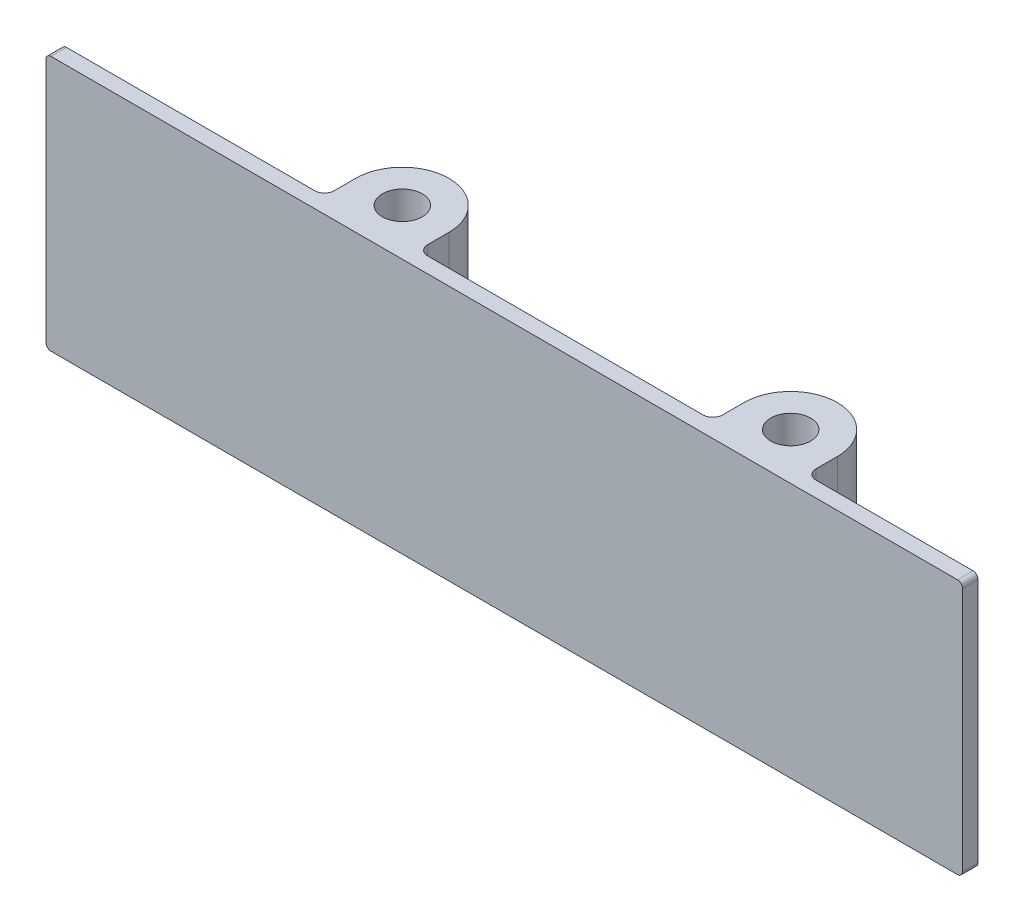
from build123d import *

# Parameters (mm, degrees)
SKETCH2_W           = 187.00242
SKETCH2_H           = 52.10048
BOSS_EXTRUDE1_DEPTH = 3.175
SKETCH4_R           = 4.074999978
BOSS_EXTRUDE2_DEPTH = 52.10048
FILLET1_R           = 2
FILLET2_R           = 1


with BuildPart() as part:
    # Sketch2 → Boss-Extrude1 (new body)
    with BuildSketch(Plane.XY):
        with Locations((93.50121, 26.05024)):
            Rectangle(SKETCH2_W, SKETCH2_H)
    extrude(amount=BOSS_EXTRUDE1_DEPTH)

    # Sketch4 → Boss-Extrude2 (add, through all)
    # profile 1 of 2: a face of its own
    with BuildSketch(Plane(origin=(0, 52.10048, 0), x_dir=(1, 0, 0), z_dir=(0, 1, 0))):
        with BuildLine():
            Line((53.64742001, 0), (72.70741999, 0))
            Line((72.70741999, 0), (72.70741999, 6.35499999))
            ThreePointArc((72.70741999, 6.35499999), (63.17742, 15.88499998), (53.64742001, 6.35499999))
            Line((53.64742001, 6.35499999), (53.64742001, 0))
        make_face()
        with Locations(Location((63.17742, 6.35499999, 0), (0, 0, 270))):
            Circle(SKETCH4_R, mode=Mode.SUBTRACT)
    # profile 2 of 2: a face of its own
    with BuildSketch(Plane(origin=(0, 52.10048, 0), x_dir=(1, 0, 0), z_dir=(0, 1, 0))):
        with BuildLine():
            Line((132.89542001, 6.35499999), (132.89542001, 0))
            Line((132.89542001, 0), (151.95541999, 0))
            Line((151.95541999, 0), (151.95541999, 6.35499999))
            ThreePointArc((151.95541999, 6.35499999), (142.42542, 15.88499998), (132.89542001, 6.35499999))
        make_face()
        with Locations(Location((142.42542, 6.35499999, 0), (0, 0, 270))):
            Circle(SKETCH4_R, mode=Mode.SUBTRACT)
    extrude(amount=-BOSS_EXTRUDE2_DEPTH)

    # Fillet1
    fillet1_edges = [part.edges().sort_by_distance(p)[0] for p in [
        (72.70741999, 26.05024, 0),
        (53.64742001, 26.05024, 0),
        (151.95541999, 26.05024, 0),
        (132.89542001, 26.05024, 0),
    ]]
    fillet(fillet1_edges, radius=FILLET1_R)

    # Fillet2
    fillet2_edges = [part.edges().sort_by_distance(p)[0] for p in [
        (0, 52.10048, 1.5875),
        (187.00242, 52.10048, 1.5875),
        (187.00242, 0, 1.5875),
        (0, 0, 1.5875),
    ]]
    fillet(fillet2_edges, radius=FILLET2_R)


solid = part.part
